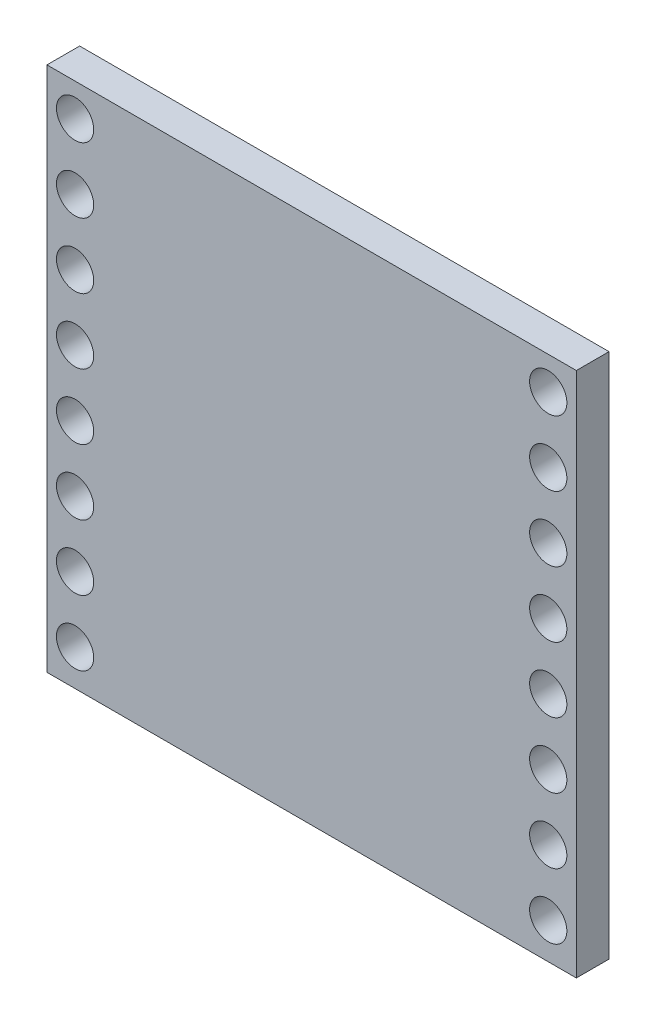
from build123d import *

# Parameters (mm, degrees)
CROQUIS1_W              = 16.2
CROQUIS1_H              = 16.1
CROQUIS1_R              = 0.57
SALIENTE_EXTRUIR1_DEPTH = 1


with BuildPart() as part:
    # Croquis1 → Saliente-Extruir1 (new body)
    with BuildSketch(Plane.XY):
        Rectangle(CROQUIS1_W, CROQUIS1_H)
        with Locations((-7.24, 7.05)):
            Circle(CROQUIS1_R, mode=Mode.SUBTRACT)
        with Locations((-7.24, 5.05)):
            Circle(CROQUIS1_R, mode=Mode.SUBTRACT)
        with Locations((-7.24, 3.05)):
            Circle(CROQUIS1_R, mode=Mode.SUBTRACT)
        with Locations((-7.24, 1.05)):
            Circle(CROQUIS1_R, mode=Mode.SUBTRACT)
        with Locations((-7.24, -0.95)):
            Circle(CROQUIS1_R, mode=Mode.SUBTRACT)
        with Locations((-7.24, -2.95)):
            Circle(CROQUIS1_R, mode=Mode.SUBTRACT)
        with Locations((-7.24, -4.95)):
            Circle(CROQUIS1_R, mode=Mode.SUBTRACT)
        with Locations((-7.24, -6.95)):
            Circle(CROQUIS1_R, mode=Mode.SUBTRACT)
        with Locations(Location((7.24, -6.95, 0), (0, 0, 180))):
            Circle(CROQUIS1_R, mode=Mode.SUBTRACT)
        with Locations(Location((7.24, -4.95, 0), (0, 0, 180))):
            Circle(CROQUIS1_R, mode=Mode.SUBTRACT)
        with Locations(Location((7.24, -2.95, 0), (0, 0, 180))):
            Circle(CROQUIS1_R, mode=Mode.SUBTRACT)
        with Locations(Location((7.24, -0.95, 0), (0, 0, 180))):
            Circle(CROQUIS1_R, mode=Mode.SUBTRACT)
        with Locations(Location((7.24, 1.05, 0), (0, 0, 180))):
            Circle(CROQUIS1_R, mode=Mode.SUBTRACT)
        with Locations(Location((7.24, 3.05, 0), (0, 0, 180))):
            Circle(CROQUIS1_R, mode=Mode.SUBTRACT)
        with Locations(Location((7.24, 5.05, 0), (0, 0, 180))):
            Circle(CROQUIS1_R, mode=Mode.SUBTRACT)
        with Locations(Location((7.24, 7.05, 0), (0, 0, 180))):
            Circle(CROQUIS1_R, mode=Mode.SUBTRACT)
    extrude(amount=SALIENTE_EXTRUIR1_DEPTH)


solid = part.part
